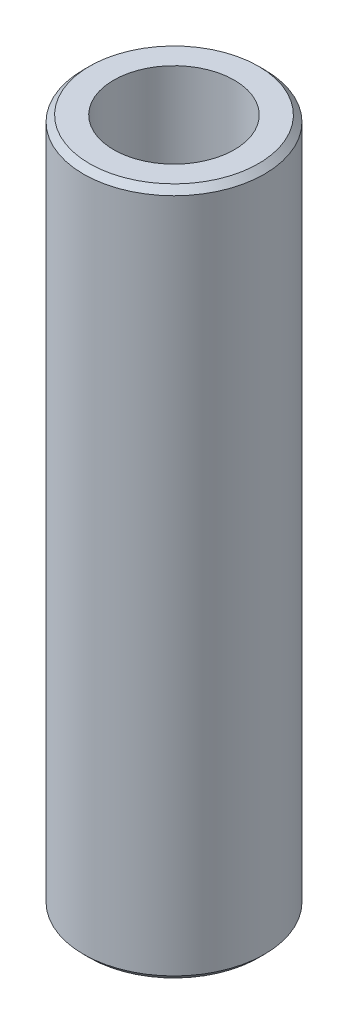
from build123d import *

# Parameters (mm, degrees)
SKETCH1_R            = 7.5
SKETCH1_R_2          = 5
CORPO_15_57_DEPTH    = 57
CHANFROS_0_5_45_SIZE = 0.5


with BuildPart() as part:
    # Sketch1 → Corpo Ø15×57 (new body)
    with BuildSketch(Plane(origin=(0, 0, 0), x_dir=(1, 0, 0), z_dir=(0, 1, 0))):
        with Locations(Location((0, 0, 0), (0, 0, 90))):
            Circle(SKETCH1_R)
        with Locations(Location((0, 0, 0), (0, 0, 90))):
            Circle(SKETCH1_R_2, mode=Mode.SUBTRACT)
    extrude(amount=CORPO_15_57_DEPTH)

    # Chanfros 0.5×45°
    chanfros_0_5_45_edges = [part.edges().sort_by_distance(p)[0] for p in [
        (0, 0, 7.5),
        (0, 57, 7.5),
    ]]
    chamfer(chanfros_0_5_45_edges, length=CHANFROS_0_5_45_SIZE)


solid = part.part
